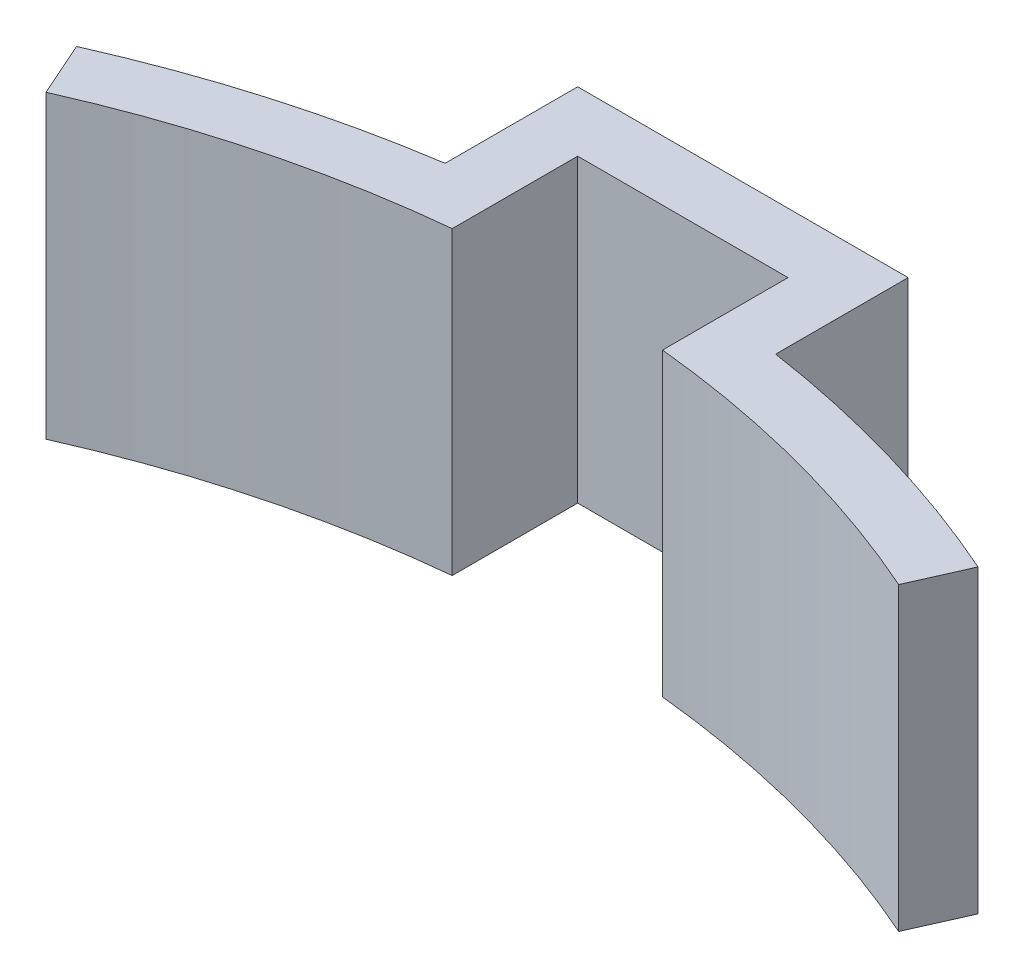
from build123d import *

# Parameters (mm, degrees)
BOSS_EXTRUDE1_DEPTH = 10


with BuildPart() as part:
    # Sketch1 → Boss-Extrude1 (new body)
    with BuildSketch(Plane(origin=(0, 0, 0), x_dir=(1, 0, 0), z_dir=(0, 1, 0))):
        with BuildLine():
            Line((-14.189189189, 31.994795048), (-15, 33.823069051))
            ThreePointArc((-15, 33.823069051), (-10.342871966, 35.524991196), (-5.5, 36.588932753))
            Line((-5.5, 36.588932753), (-5.5, 41))
            Line((-5.5, 41), (5.5, 41))
            Line((5.5, 41), (5.5, 36.588932753))
            ThreePointArc((5.5, 36.588932753), (10.342871966, 35.524991196), (15, 33.823069051))
            Line((15, 33.823069051), (14.189189189, 31.994795048))
            ThreePointArc((14.189189189, 31.994795048), (8.957050094, 33.834468425), (3.5, 34.824560299))
            Line((3.5, 34.824560299), (3.5, 39))
            Line((3.5, 39), (-3.5, 39))
            Line((-3.5, 39), (-3.5, 34.824560299))
            ThreePointArc((-3.5, 34.824560299), (-8.957050094, 33.834468425), (-14.189189189, 31.994795048))
        make_face()
    extrude(amount=BOSS_EXTRUDE1_DEPTH)


solid = part.part
